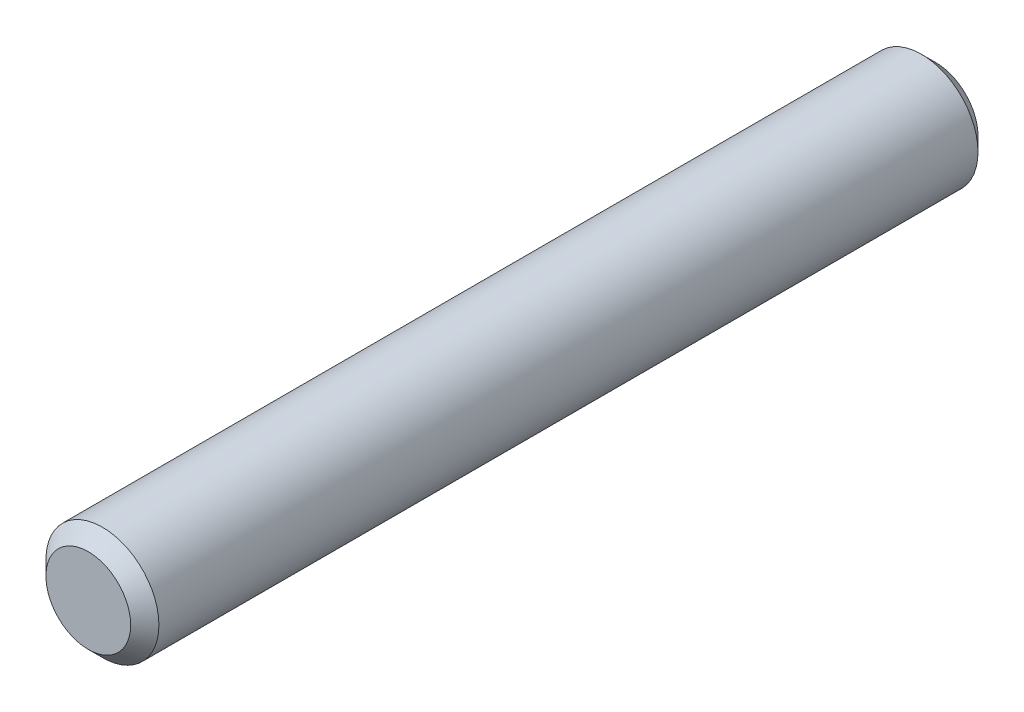
from build123d import *

# Parameters (mm, degrees)
SKETCH1_R           = 2
BOSS_EXTRUDE1_DEPTH = 15
CHAMFER1_SIZE       = 0.5


with BuildPart() as part:
    # Sketch1 → Boss-Extrude1 (new, symmetric)
    with BuildSketch(Plane.XY):
        Circle(SKETCH1_R)
    extrude(amount=BOSS_EXTRUDE1_DEPTH, both=True)

    # Chamfer1
    chamfer1_edges = [part.edges().sort_by_distance(p)[0] for p in [
        (-2, 0, -15),
        (-2, 0, 15),
    ]]
    chamfer(chamfer1_edges, length=CHAMFER1_SIZE)


solid = part.part
